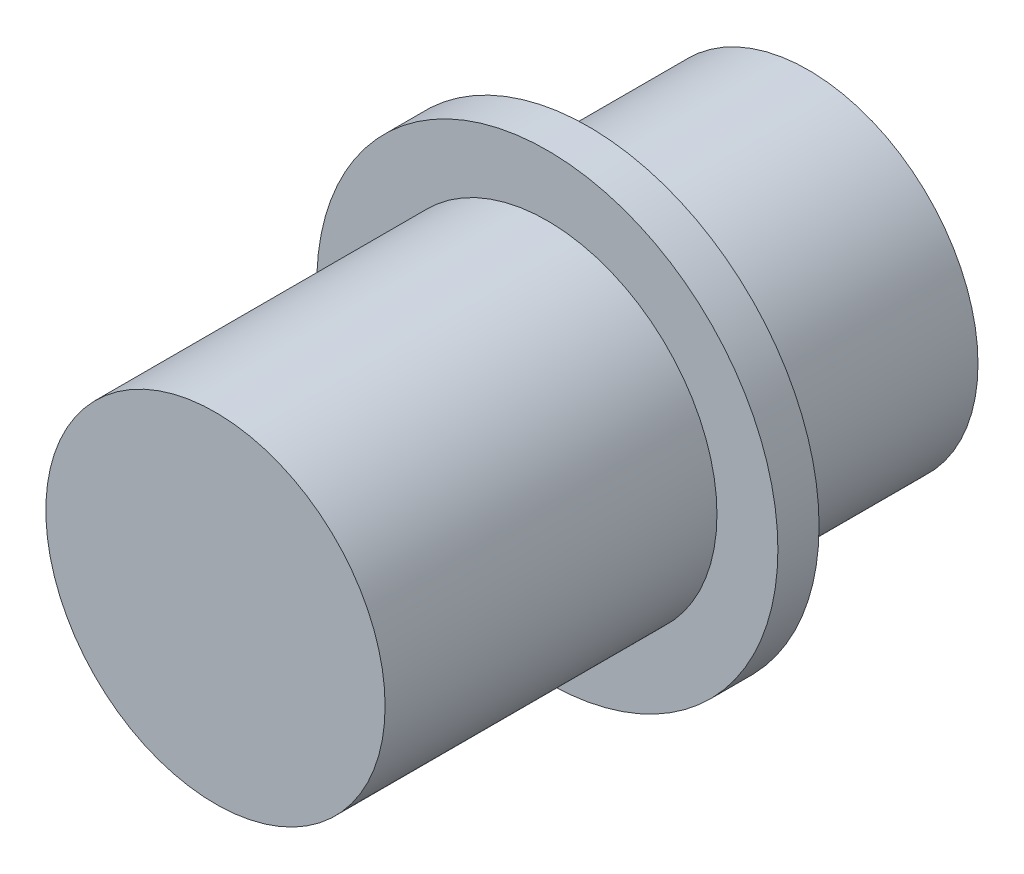
from build123d import *

# Parameters (mm, degrees)
SKETCH1_R           = 10.3
BOSS_EXTRUDE1_DEPTH = 20.15
SKETCH1_3_R         = 14
BOSS_EXTRUDE2_DEPTH = 2.5
BOSS_EXTRUDE3_START = -15.85
SKETCH1_4_R         = 10.3
BOSS_EXTRUDE3_DEPTH = 15.85


with BuildPart() as part:
    # Sketch1 → Boss-Extrude1 (new body)
    with BuildSketch(Plane.XY):
        Circle(SKETCH1_R)
    extrude(amount=BOSS_EXTRUDE1_DEPTH)

    # Sketch1<3> → Boss-Extrude2 (add)
    with BuildSketch(Plane.XY):
        Circle(SKETCH1_3_R)
    extrude(amount=-BOSS_EXTRUDE2_DEPTH)

    # Sketch1<4> → Boss-Extrude3 (add)
    with BuildSketch(Plane.XY.offset(BOSS_EXTRUDE3_START)):
        Circle(SKETCH1_4_R)
    extrude(amount=BOSS_EXTRUDE3_DEPTH)


solid = part.part
